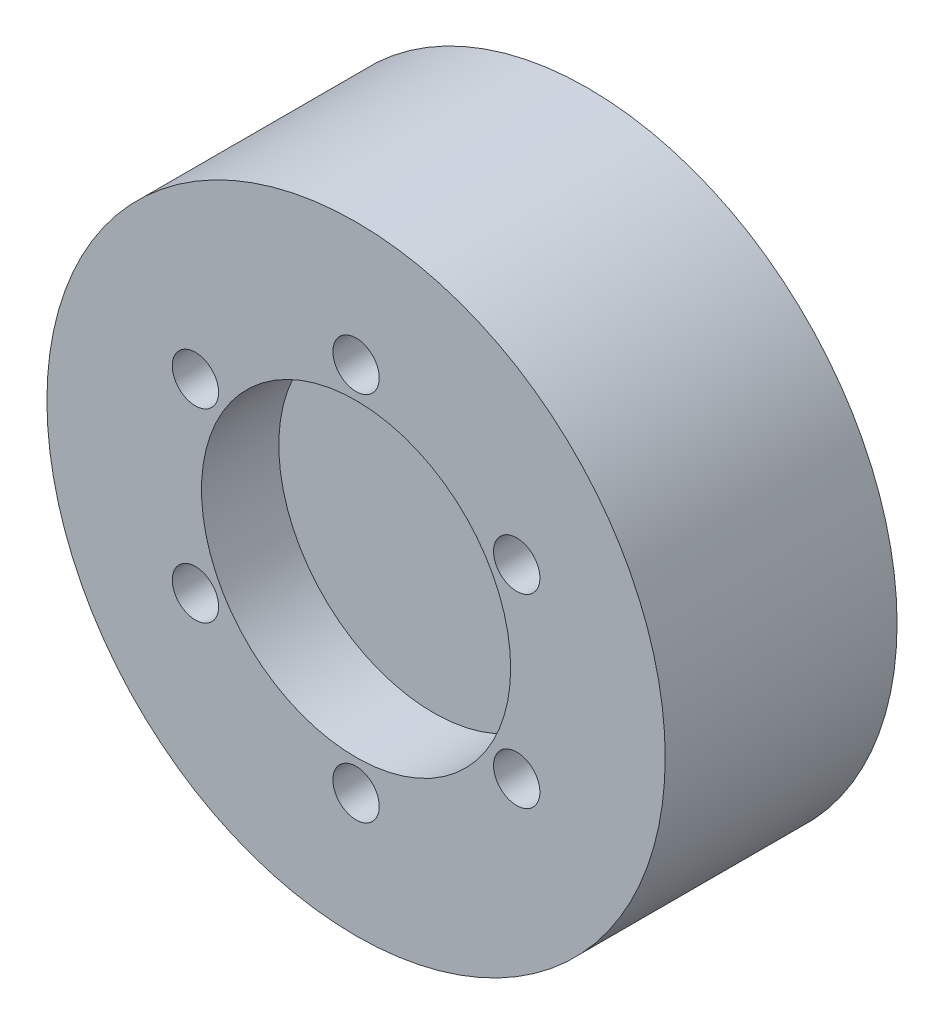
from build123d import *

# Parameters (mm, degrees)
SKETCH1_R           = 20
BOSS_EXTRUDE1_DEPTH = 15
SKETCH2_R           = 10
CUT_EXTRUDE1_DEPTH  = 5
SKETCH7_R           = 17.5
CUT_EXTRUDE2_DEPTH  = 3
SKETCH8_R           = 1.5
CUT_EXTRUDE3_DEPTH  = 5


with BuildPart() as part:
    # Sketch1 → Boss-Extrude1 (new body)
    with BuildSketch(Plane.XY):
        Circle(SKETCH1_R)
    extrude(amount=BOSS_EXTRUDE1_DEPTH)

    # Sketch2 → Cut-Extrude1 (cut)
    with BuildSketch(Plane.XY.offset(15)):
        Circle(SKETCH2_R)
    extrude(amount=-CUT_EXTRUDE1_DEPTH, mode=Mode.SUBTRACT)

    # Sketch7 → Cut-Extrude2 (cut)
    with BuildSketch(Plane(origin=(0, 0, 0), x_dir=(-1, 0, 0), z_dir=(0, 0, -1))):
        Circle(SKETCH7_R)
    extrude(amount=-CUT_EXTRUDE2_DEPTH, mode=Mode.SUBTRACT)

    # Sketch8 → Cut-Extrude3 (cut)
    with BuildSketch(Plane.XY.offset(15)):
        with Locations((0, 12)):
            Circle(SKETCH8_R)
        with Locations((10.392304845, 6)):
            Circle(SKETCH8_R)
        with Locations((10.392304845, -6)):
            Circle(SKETCH8_R)
        with Locations((0, -12)):
            Circle(SKETCH8_R)
        with Locations((-10.392304845, -6)):
            Circle(SKETCH8_R)
        with Locations((-10.392304845, 6)):
            Circle(SKETCH8_R)
    extrude(amount=-CUT_EXTRUDE3_DEPTH, mode=Mode.SUBTRACT)


solid = part.part
